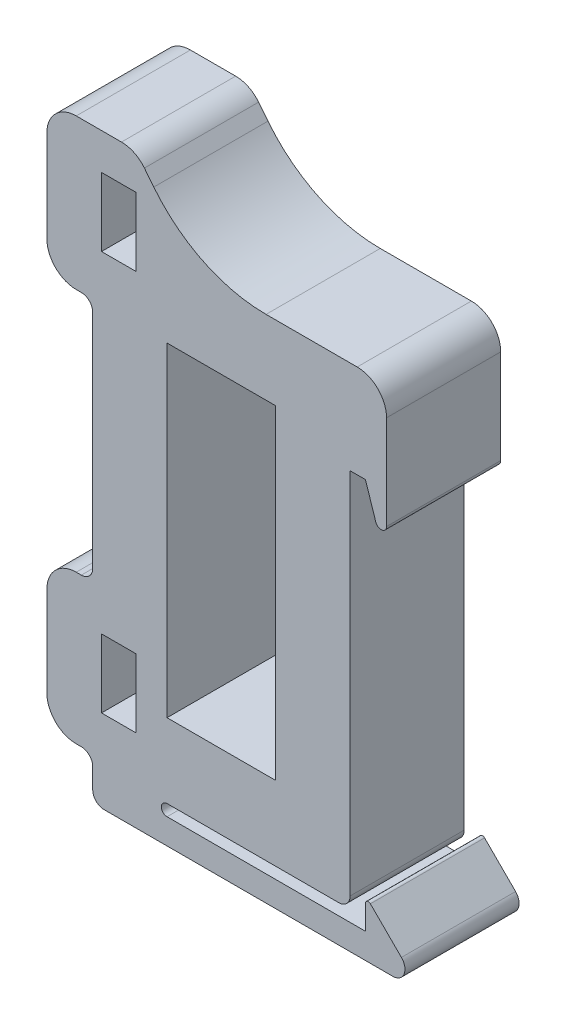
from build123d import *

# Parameters (mm, degrees)
SKETCH2_W           = 9.52
SKETCH2_H           = 28.42
SKETCH2_W_2         = 3.01
SKETCH2_H_2         = 6
BOSS_EXTRUDE1_DEPTH = 10
SKETCH3_R           = 1.96857517
CUT_EXTRUDE1_DEPTH  = 9
FILLET1_R           = 1


with BuildPart() as part:
    # Sketch2 → Boss-Extrude1 (new body)
    with BuildSketch(Plane.XY):
        with BuildLine():
            Line((0, 66.651771766), (0, 33.391771766))
            Line((0, 33.391771766), (-16.03, 33.391771766))
            ThreePointArc((-16.03, 33.391771766), (-16.53, 32.891771766), (-16.03, 32.391771766))
            Line((-16.03, 32.391771766), (1.352234191, 32.391771766))
            Line((1.352234191, 32.391771766), (1.352234191, 34.518218659))
            ThreePointArc((1.352234191, 34.518218659), (1.506462672, 34.749146821), (1.77885672, 34.695149386))
            Line((1.77885672, 34.695149386), (4.496782459, 31.98195805))
            ThreePointArc((4.496782459, 31.98195805), (4.727391952, 30.826554208), (3.747902937, 30.171771766))
            Line((3.747902937, 30.171771766), (-21.54, 30.171771766))
            ThreePointArc((-21.54, 30.171771766), (-22.247106781, 30.464664985), (-22.54, 31.171771766))
            Line((-22.54, 31.171771766), (-22.54, 32.942649485))
            ThreePointArc((-22.54, 32.942649485), (-22.832893219, 33.649756266), (-23.54, 33.942649485))
            Line((-23.54, 33.942649485), (-23.98462025, 33.942649485))
            ThreePointArc((-23.98462025, 33.942649485), (-25.801884678, 34.695385057), (-26.55462025, 36.512649485))
            Line((-26.55462025, 36.512649485), (-26.55462025, 44.391771766))
            ThreePointArc((-26.55462025, 44.391771766), (-25.801884678, 46.209036193), (-23.98462025, 46.961771766))
            Line((-23.98462025, 46.961771766), (-23.54, 46.961771766))
            ThreePointArc((-23.54, 46.961771766), (-22.832893219, 47.254664985), (-22.54, 47.961771766))
            Line((-22.54, 47.961771766), (-22.54, 67.401771766))
            ThreePointArc((-22.54, 67.401771766), (-22.832893219, 68.108878547), (-23.54, 68.401771766))
            Line((-23.54, 68.401771766), (-23.98462025, 68.401771766))
            ThreePointArc((-23.98462025, 68.401771766), (-25.801884678, 69.154507338), (-26.55462025, 70.971771766))
            Line((-26.55462025, 70.971771766), (-26.55462025, 77.401771766))
            Line((-26.55462025, 77.401771766), (-26.55462025, 79.000903717))
            ThreePointArc((-26.55462025, 79.000903717), (-25.801884678, 80.818168145), (-23.98462025, 81.570903717))
            Line((-23.98462025, 81.570903717), (-20.021565093, 81.570903717))
            ThreePointArc((-20.021565093, 81.570903717), (-18.905624991, 81.31597989), (-18.011069886, 80.601781295))
            Line((-18.011069886, 80.601781295), (-17.190935487, 79.571798553))
            ThreePointArc((-17.190935487, 79.571798553), (-12.815621218, 76.078617097), (-7.357501728, 74.831771766))
            Line((-7.357501728, 74.831771766), (0.623852111, 74.831771766))
            ThreePointArc((0.623852111, 74.831771766), (2.441116539, 74.079036193), (3.193852111, 72.261771766))
            Line((3.193852111, 72.261771766), (3.193852111, 64.016682225))
            ThreePointArc((3.193852111, 64.016682225), (2.79053513, 63.543838386), (2.26, 63.867533241))
            Line((2.26, 63.867533241), (1.347357771, 66.651771766))
            Line((1.347357771, 66.651771766), (0, 66.651771766))
        make_face()
        with Locations((-11.27, 54.111771766)):
            Rectangle(SKETCH2_W, SKETCH2_H, mode=Mode.SUBTRACT)
        with Locations((-20.2649024, 75.392647139)):
            Rectangle(SKETCH2_W_2, SKETCH2_H_2, mode=Mode.SUBTRACT)
        with Locations((-20.2649024, 40.392647139)):
            Rectangle(SKETCH2_W_2, SKETCH2_H_2, mode=Mode.SUBTRACT)
    extrude(amount=BOSS_EXTRUDE1_DEPTH)

    # Sketch3 → Cut-Extrude1 (cut)
    with BuildSketch(Plane.ZY.offset(26.55462025)):
        with Locations(Location((5, 40.452210625, 0), (0, 0, 270))):
            Circle(SKETCH3_R)
        with Locations(Location((5, 74.986337741, 0), (0, 0, 270))):
            Circle(SKETCH3_R)
    extrude(amount=-CUT_EXTRUDE1_DEPTH, mode=Mode.SUBTRACT)

    # Fillet1
    fillet1_edges = [part.edges().sort_by_distance(p)[0] for p in [
        (0, 33.391771766, 5),
    ]]
    fillet(fillet1_edges, radius=FILLET1_R)


solid = part.part
